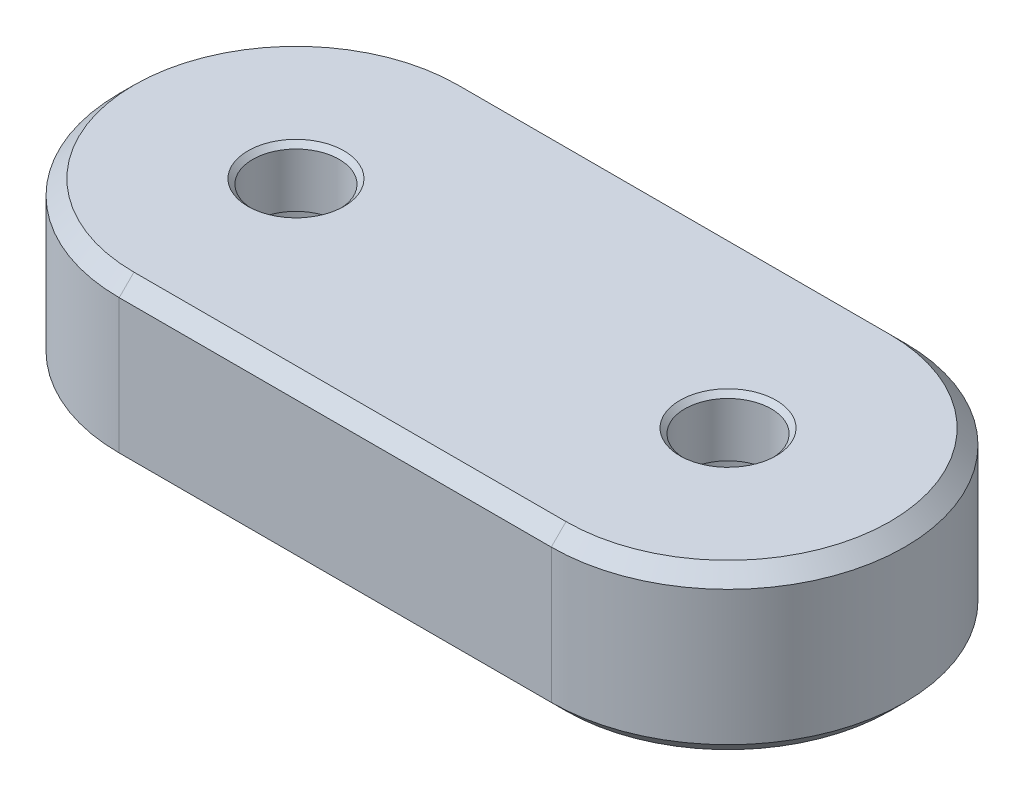
from build123d import *

# Parameters (mm, degrees)
SKETCH1_R           = 4.6
BOSS_EXTRUDE1_DEPTH = 5.35
BOSS_EXTRUDE2_START = 3
SKETCH1_3_R         = 2.2
BOSS_EXTRUDE2_DEPTH = 3
CHAMFER1_SIZE       = 0.75
CHAMFER2_SIZE       = 0.25


with BuildPart() as part:
    # Sketch1 → Boss-Extrude1 (new body)
    with BuildSketch(Plane(origin=(0, 0, 0), x_dir=(1, 0, 0), z_dir=(0, 1, 0))):
        with BuildLine():
            Line((22, 9), (0, 9))
            ThreePointArc((0, 9), (-9, 0), (0, -9))
            Line((0, -9), (22, -9))
            ThreePointArc((22, -9), (31, 0), (22, 9))
        make_face()
        Circle(SKETCH1_R, mode=Mode.SUBTRACT)
        with Locations((22, 0)):
            Circle(SKETCH1_R, mode=Mode.SUBTRACT)
    extrude(amount=-BOSS_EXTRUDE1_DEPTH)

    # Sketch1<3> → Boss-Extrude2 (add)
    with BuildSketch(Plane(origin=(0, 0, 0), x_dir=(1, 0, 0), z_dir=(0, 1, 0)).offset(BOSS_EXTRUDE2_START)):
        with BuildLine():
            Line((22, 9), (0, 9))
            ThreePointArc((0, 9), (-9, 0), (0, -9))
            Line((0, -9), (22, -9))
            ThreePointArc((22, -9), (31, 0), (22, 9))
        make_face()
        Circle(SKETCH1_3_R, mode=Mode.SUBTRACT)
        with Locations((22, 0)):
            Circle(SKETCH1_3_R, mode=Mode.SUBTRACT)
    extrude(amount=-BOSS_EXTRUDE2_DEPTH)

    # Chamfer1
    chamfer1_edges = [part.edges().sort_by_distance(p)[0] for p in [
        (17.4, -5.35, 0),
        (-4.6, -5.35, 0),
        (11, -5.35, -9),
        (-9, -5.35, 0),
        (31, -5.35, 0),
        (11, -5.35, 9),
        (11, 3, -9),
        (-9, 3, 0),
        (31, 3, 0),
        (11, 3, 9),
    ]]
    chamfer(chamfer1_edges, length=CHAMFER1_SIZE)

    # Chamfer2
    chamfer2_edges = [part.edges().sort_by_distance(p)[0] for p in [
        (19.8, 3, 0),
        (-2.2, 3, 0),
    ]]
    chamfer(chamfer2_edges, length=CHAMFER2_SIZE)


solid = part.part
